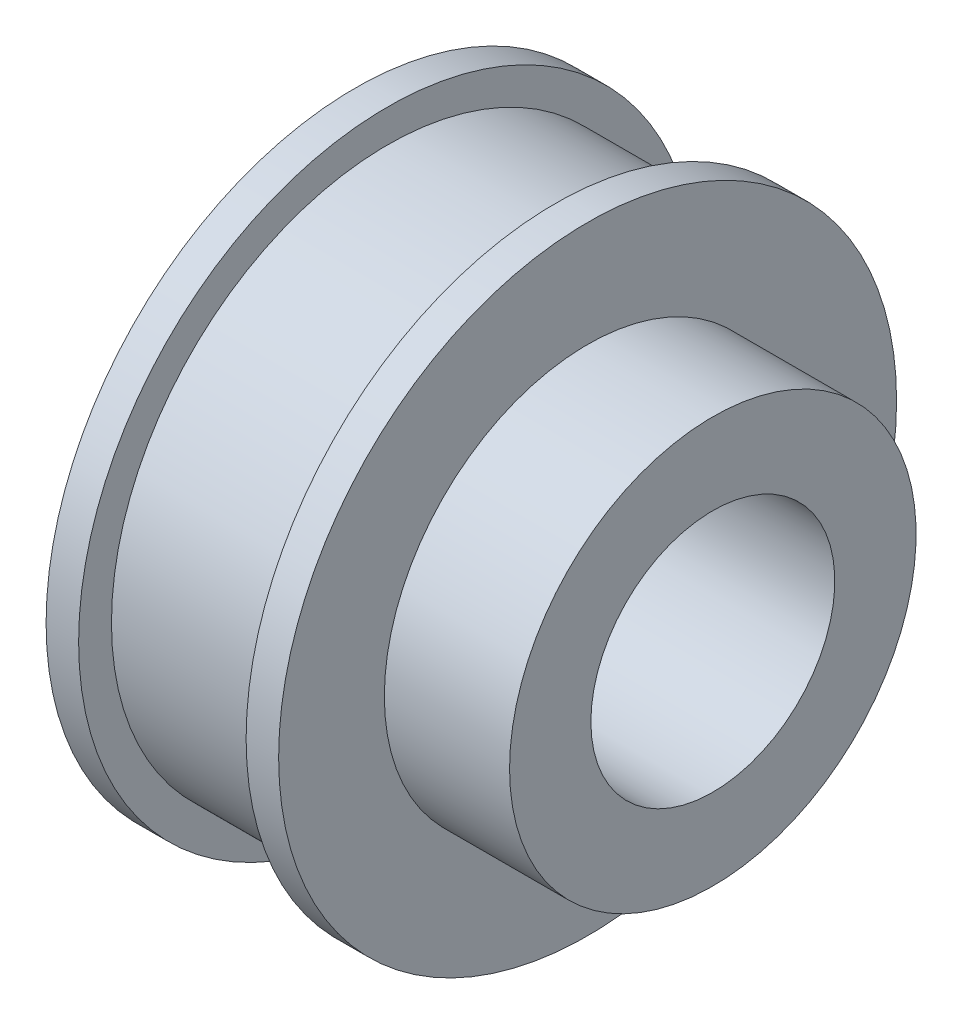
from build123d import *


with BuildPart() as part:
    # Esquisse1 → Révolution1 (revolve)
    with BuildSketch(Plane.XY, mode=Mode.PRIVATE) as r_volution1_sk:
        Polygon((22, 7.5), (22, 12.5), (14.3, 12.5), (14.3, 19), (12.3, 19), (12.3, 16.98), (2, 16.98), (2, 19), (0, 19), (0, 7.5), align=None)
    revolve(r_volution1_sk.sketch.rotate(Axis((0, 0, 0), (1, 0, 0)), 90), axis=Axis((0, 0, 0), (1, 0, 0)))


solid = part.part
